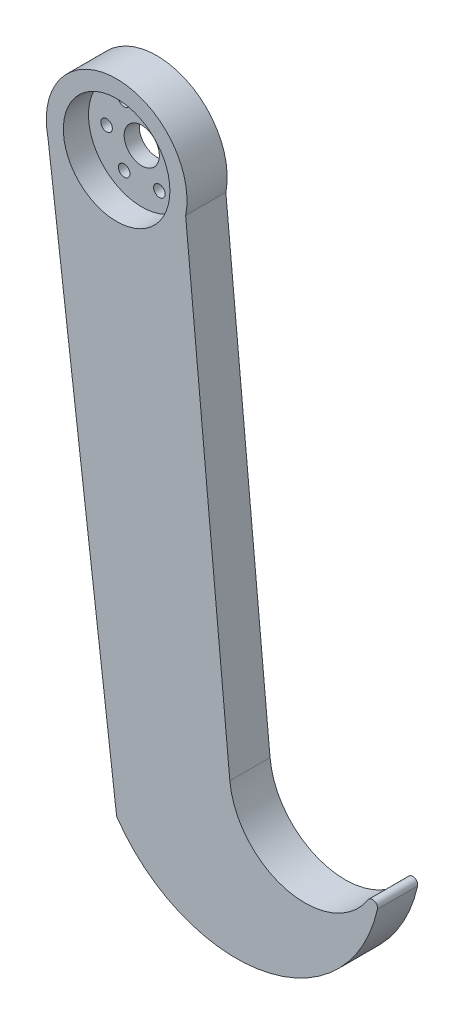
from build123d import *

# Parameters (mm, degrees)
SKETCH_1_R          = 14
EXTRUDE_1_DEPTH     = 8
SKETCH_3_R          = 3.5
CUT_EXTRUDE_2_DEPTH = 10
EXTRUDE_START       = -8
EXTRUDE_3_DEPTH     = 8
FILLET_1_R          = 1
FILLET_2_R          = 1
SKETCH_8_R          = 10.6
CUT_EXTRUDE_5_DEPTH = 5
SKETCH_9_R          = 1.15
CUT_EXTRUDE_6_DEPTH = 5


with BuildPart() as part:
    # 스케치1 → 보스-돌출1 (new body)
    with BuildSketch(Plane.XY):
        Circle(SKETCH_1_R)
    extrude(amount=EXTRUDE_1_DEPTH)

    # 스케치3 → 컷-돌출2 (cut)
    with BuildSketch(Plane.XY.offset(8)):
        Circle(SKETCH_3_R)
    extrude(amount=-CUT_EXTRUDE_2_DEPTH, mode=Mode.SUBTRACT)

    # 스케치6 → 보스-돌출3 (add)
    with BuildSketch(Plane.XY.offset(8).offset(EXTRUDE_START)):
        with BuildLine():
            Line((13.735578357, -2.708115061), (22.528484651, -95.708115061))
            ThreePointArc((22.528484651, -95.708115061), (38.172657843, -109.27935171), (52.461884597, -94.288133687))
            ThreePointArc((52.461884597, -94.288133687), (33.515079478, -123.998980013), (0, -113.115264599))
            Line((0, -113.115264599), (-13.64899727, -3.115264599))
            ThreePointArc((-13.64899727, -3.115264599), (0.208126783, -13.998452887), (13.735578357, -2.708115061))
        make_face()
    extrude(amount=EXTRUDE_3_DEPTH)

    # 필렛1
    fillet_1_edges = [part.edges().sort_by_distance(p)[0] for p in [
        (52.461884597, -94.288133687, 4),
    ]]
    fillet(fillet_1_edges, radius=FILLET_1_R)

    # 필렛2
    fillet_2_edges = [part.edges().sort_by_distance(p)[0] for p in [
        (0, -113.115264599, 4),
    ]]
    fillet(fillet_2_edges, radius=FILLET_2_R)

    # 스케치8 → 컷-돌출5 (cut)
    with BuildSketch(Plane.XY.offset(8)):
        Circle(SKETCH_8_R)
    extrude(amount=-CUT_EXTRUDE_5_DEPTH, mode=Mode.SUBTRACT)

    # 스케치9 → 컷-돌출6 (cut)
    with BuildSketch(Plane.XY.offset(3)):
        with Locations((7, 0)):
            Circle(SKETCH_9_R)
        with Locations((3.5, -6.062177826)):
            Circle(SKETCH_9_R)
        with Locations((-3.5, -6.062177826)):
            Circle(SKETCH_9_R)
        with Locations((-7, 0)):
            Circle(SKETCH_9_R)
        with Locations((-3.5, 6.062177826)):
            Circle(SKETCH_9_R)
        with Locations((3.5, 6.062177826)):
            Circle(SKETCH_9_R)
    extrude(amount=-CUT_EXTRUDE_6_DEPTH, mode=Mode.SUBTRACT)


solid = part.part
